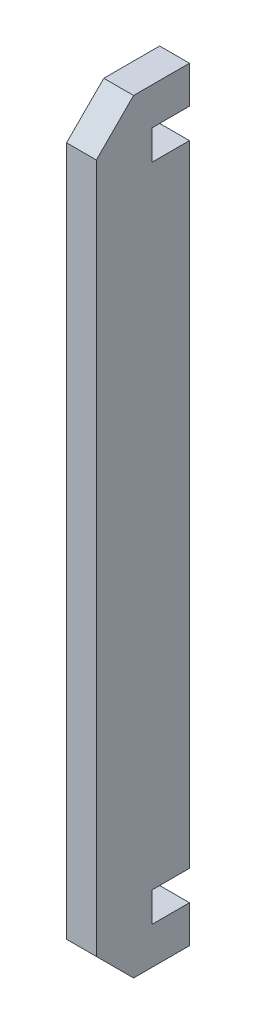
from build123d import *

# Parameters (mm, degrees)
SKETCH1_W           = 42.3
SKETCH1_H           = 5
BOSS_EXTRUDE1_DEPTH = 4
CHAMFER1_SIZE       = 5


with BuildPart() as part:
    # Sketch1 → Boss-Extrude1 (new body)
    with BuildSketch(Plane.YZ):
        Polygon((-21.921641791, 5.223880597), (-17.921641791, 5.223880597), (24.378358209, 5.223880597), (66.678358209, 5.223880597), (70.678358209, 5.223880597), (70.678358209, 0.223880597), (75.678358209, 0.223880597), (75.678358209, 12.723880597), (-26.921641791, 12.723880597), (-26.921641791, 0.223880597), (-21.921641791, 0.223880597), align=None)
        with Locations((3.228358209, 2.723880597)):
            Rectangle(SKETCH1_W, SKETCH1_H)
        with Locations((45.528358209, 2.723880597)):
            Rectangle(SKETCH1_W, SKETCH1_H)
    extrude(amount=BOSS_EXTRUDE1_DEPTH)

    # Chamfer1
    chamfer1_edges = [part.edges().sort_by_distance(p)[0] for p in [
        (2, -26.921641791, 12.723880597),
        (2, 75.678358209, 12.723880597),
    ]]
    chamfer(chamfer1_edges, length=CHAMFER1_SIZE)


solid = part.part
